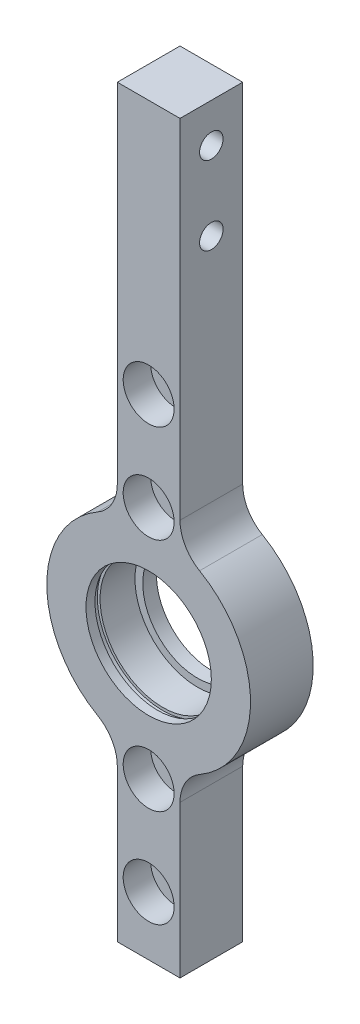
from build123d import *

# Parameters (mm, degrees)
SKETCH1_R           = 26
SKETCH1_R_2         = 14
BOSS_EXTRUDE1_DEPTH = 8
BOSS_EXTRUDE2_DEPTH = 8
SKETCH3_W           = 12.5
SKETCH3_H           = 2
SKETCH4_W           = 1.3
SKETCH4_H           = 0.7
SKETCH5_W           = 16
SKETCH5_H           = 45.261366246
BOSS_EXTRUDE3_DEPTH = 8
FILLET1_R           = 10
SKETCH6_R           = 3
CUT_EXTRUDE1_DEPTH  = 125.9799984
SKETCH9_R           = 6.5
CUT_EXTRUDE4_DEPTH  = 7
SKETCH10_R          = 3
CUT_EXTRUDE5_DEPTH  = 124.822453537


with BuildPart() as part:
    # Sketch1 → Boss-Extrude1 (new, symmetric)
    with BuildSketch(Plane.XY):
        Circle(SKETCH1_R)
        Circle(SKETCH1_R_2, mode=Mode.SUBTRACT)
    extrude(amount=BOSS_EXTRUDE1_DEPTH, both=True)

    # Sketch2 → Boss-Extrude2 (add, symmetric)
    with BuildSketch(Plane.XY):
        Polygon((-8, 120), (8, 120), (8, 24.738633754), (0, 26), (-8, 24.738633754), align=None)
    extrude(amount=BOSS_EXTRUDE2_DEPTH, both=True)

    # Sketch3 → Cut-Revolve1 (revolve, cut)
    with BuildSketch(Plane(origin=(0, 0, 0), x_dir=(0, 0, -1), z_dir=(1, 0, 0)), mode=Mode.PRIVATE) as cut_revolve1_sk:
        with Locations((-1.75, 15)):
            Rectangle(SKETCH3_W, SKETCH3_H)
    revolve(cut_revolve1_sk.sketch.rotate(Axis((0, 0, 0), (0, 0, -1)), 90), axis=Axis((0, 0, 0), (0, 0, -1)), mode=Mode.SUBTRACT)

    # Sketch4 → Cut-Revolve2 (revolve, cut)
    with BuildSketch(Plane(origin=(0, 0, 0), x_dir=(0, 0, -1), z_dir=(1, 0, 0)), mode=Mode.PRIVATE) as cut_revolve2_sk:
        with Locations((-5.05, 16.35)):
            Rectangle(SKETCH4_W, SKETCH4_H)
    revolve(cut_revolve2_sk.sketch.rotate(Axis((0, 0, 0), (0, 0, -1)), 90), axis=Axis((0, 0, 0), (0, 0, -1)), mode=Mode.SUBTRACT)

    # Sketch5 → Boss-Extrude3 (add, symmetric)
    with BuildSketch(Plane.XY):
        with Locations((0, -47.369316877)):
            Rectangle(SKETCH5_W, SKETCH5_H)
    extrude(amount=BOSS_EXTRUDE3_DEPTH, both=True)

    # Fillet1
    fillet1_edges = [part.edges().sort_by_distance(p)[0] for p in [
        (8, 24.738633754, 0),
        (-8, 24.738633754, 0),
        (8, -24.738633754, 0),
        (-8, -24.738633754, 0),
    ]]
    fillet(fillet1_edges, radius=FILLET1_R)

    # Sketch6 → Cut-Extrude1 (cut, through all)
    with BuildSketch(Plane.ZY.offset(8)):
        with Locations(Location((0, 110, 0), (0, 0, 270))):
            Circle(SKETCH6_R)
        with Locations(Location((0, 90, 0), (0, 0, 270))):
            Circle(SKETCH6_R)
    extrude(amount=-CUT_EXTRUDE1_DEPTH, mode=Mode.SUBTRACT)

    # Sketch9 → Cut-Extrude4 (cut)
    with BuildSketch(Plane.XY.offset(8)):
        with Locations((0, -55)):
            Circle(SKETCH9_R)
        with Locations((0, -30)):
            Circle(SKETCH9_R)
    cut_extrude4 = extrude(amount=-CUT_EXTRUDE4_DEPTH, mode=Mode.SUBTRACT)

    # Sketch10 → Cut-Extrude5 (cut, through all)
    with BuildSketch(Plane.XY.offset(8)):
        with Locations((0, -30)):
            Circle(SKETCH10_R)
        with Locations((0, -55)):
            Circle(SKETCH10_R)
    cut_extrude5 = extrude(amount=-CUT_EXTRUDE5_DEPTH, mode=Mode.SUBTRACT)

    # Mirror1: Cut-Extrude4 across plane
    add(cut_extrude4.mirror(Plane.ZX), mode=Mode.SUBTRACT)

    # Mirror2: Cut-Extrude5 across plane
    add(cut_extrude5.mirror(Plane.ZX), mode=Mode.SUBTRACT)


solid = part.part
